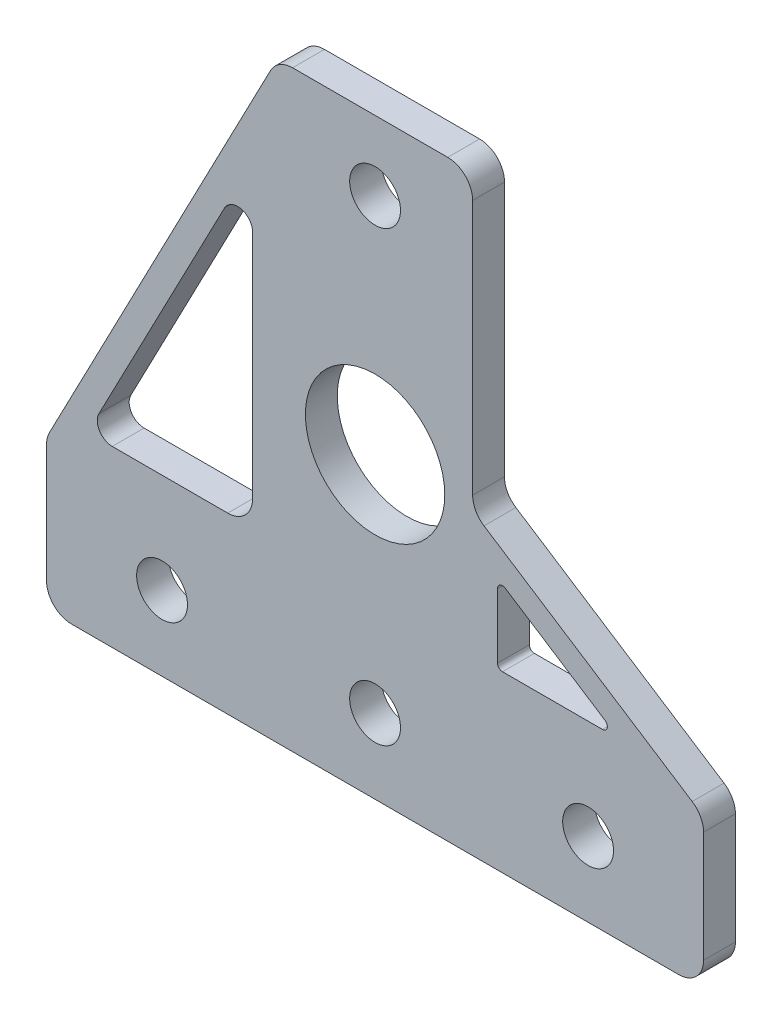
from build123d import *

# Parameters (mm, degrees)
SKETCH1_W                          = 19.6
SKETCH1_H                          = 44.5
SKETCH1_R                          = 2.5527
SKETCH1_R_2                        = 7
SKETCH1_H_2                        = 15
BOSS_EXTRUDE1_DEPTH                = 3.2
SKETCH2_W                          = 23.2
SKETCH2_H                          = 15
SKETCH2_R                          = 2.5527
T_SHAPE_EXTENSION_DEPTH            = 3.2
ASYMMETRIC_TRIANGLE_SUPPORTS_DEPTH = 3.2
FILLET1_R                          = 1.5
FILLET2_R                          = 2.5
FILLET3_R                          = 0.5
FILLET4_R                          = 2.5


with BuildPart() as part:
    # Sketch1 → Boss-Extrude1 (new body)
    # profile 1 of 2: a face of its own
    with BuildSketch(Plane.XY):
        with Locations((0, 47.25)):
            Rectangle(SKETCH1_W, SKETCH1_H)
        with Locations((0, 62.5)):
            Circle(SKETCH1_R, mode=Mode.SUBTRACT)
        with Locations((0, 40)):
            Circle(SKETCH1_R_2, mode=Mode.SUBTRACT)
    # profile 2 of 2: a face of its own
    with BuildSketch(Plane.XY):
        with Locations((0, 17.5)):
            Rectangle(SKETCH1_W, SKETCH1_H_2)
        with Locations((0, 17.5)):
            Circle(SKETCH1_R, mode=Mode.SUBTRACT)
    extrude(amount=BOSS_EXTRUDE1_DEPTH)

    # Sketch2 → T-shape Extension (add)
    # profile 1 of 2: a face of its own
    with BuildSketch(Plane.XY.offset(3.2)):
        with Locations((21.4, 17.5)):
            Rectangle(SKETCH2_W, SKETCH2_H)
        with Locations((21.4, 17.5)):
            Circle(SKETCH2_R, mode=Mode.SUBTRACT)
    # profile 2 of 2: a face of its own
    with BuildSketch(Plane.XY.offset(3.2)):
        with Locations((-21.4, 17.5)):
            Rectangle(SKETCH2_W, SKETCH2_H)
        with Locations((-21.4, 17.5)):
            Circle(SKETCH2_R, mode=Mode.SUBTRACT)
    extrude(amount=-T_SHAPE_EXTENSION_DEPTH)

    # Sketch8 → Asymmetric Triangle Supports (add)
    # profile 1 of 2: a face of its own
    with BuildSketch(Plane.XY.offset(3.2)):
        Polygon((-9.8, 69.5), (-33, 25), (-9.8, 25), align=None)
        Polygon((-12.3, 59.296922481), (-12.3, 27.5), (-28.877271945, 27.5), align=None, mode=Mode.SUBTRACT)
    # profile 2 of 2: a face of its own
    with BuildSketch(Plane.XY.offset(3.2)):
        Polygon((9.8, 25), (33, 25), (9.8, 40), align=None)
        Polygon((12.3, 27.5), (12.3, 35.40659498), (24.528866903, 27.5), align=None, mode=Mode.SUBTRACT)
    extrude(amount=-ASYMMETRIC_TRIANGLE_SUPPORTS_DEPTH)

    # Fillet1
    fillet1_edges = [part.edges().sort_by_distance(p)[0] for p in [
        (-28.877271945, 27.5, 1.6),
        (-12.3, 59.296922481, 1.6),
    ]]
    fillet(fillet1_edges, radius=FILLET1_R)

    # Fillet2
    fillet2_edges = [part.edges().sort_by_distance(p)[0] for p in [
        (-12.3, 27.5, 1.6),
    ]]
    fillet(fillet2_edges, radius=FILLET2_R)

    # Fillet3
    fillet3_edges = [part.edges().sort_by_distance(p)[0] for p in [
        (24.528866903, 27.5, 1.6),
        (12.3, 27.5, 1.6),
        (12.3, 35.40659498, 1.6),
    ]]
    fillet(fillet3_edges, radius=FILLET3_R)

    # Fillet4
    fillet4_edges = [part.edges().sort_by_distance(p)[0] for p in [
        (-9.8, 69.5, 1.6),
        (9.8, 69.5, 1.6),
        (33, 25, 1.6),
        (33, 10, 1.6),
        (-33, 10, 1.6),
        (-33, 25, 1.6),
        (9.8, 40, 1.6),
    ]]
    fillet(fillet4_edges, radius=FILLET4_R)


solid = part.part
